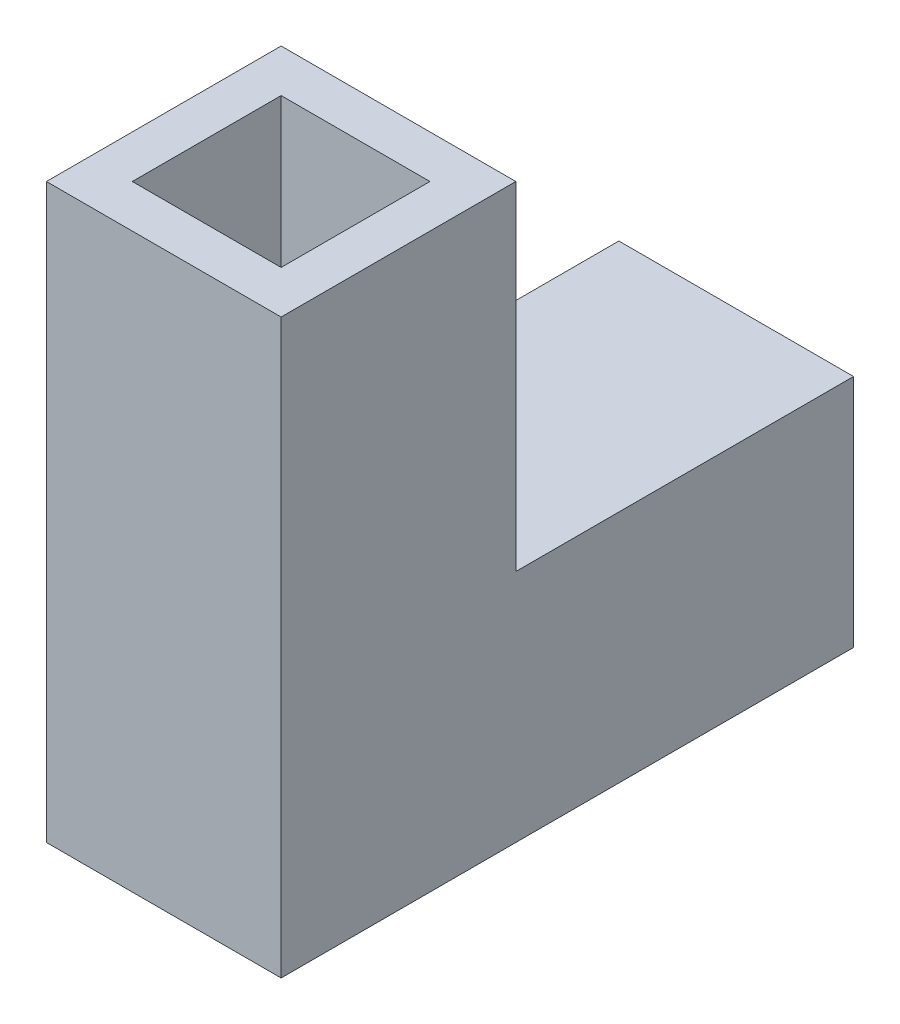
from build123d import *

# Parameters (mm, degrees)
SKETCH1_W           = 8.2
SKETCH1_H           = 8.2
SKETCH1_W_2         = 5.2
SKETCH1_H_2         = 5.2
BOSS_EXTRUDE1_DEPTH = 20
SKETCH2_W           = 8.2
SKETCH2_H           = 8.2
BOSS_EXTRUDE2_DEPTH = 20
SHELL1_T            = -1.5


with BuildPart() as part:
    # Sketch1 → Boss-Extrude1 (new body)
    # profile 1 of 2: a face of its own
    with BuildSketch(Plane(origin=(0, 0, 0), x_dir=(1, 0, 0), z_dir=(0, 1, 0))):
        Rectangle(SKETCH1_W, SKETCH1_H)
        Rectangle(SKETCH1_W_2, SKETCH1_H_2, mode=Mode.SUBTRACT)
    # profile 2 of 2: a face of its own
    with BuildSketch(Plane(origin=(0, 0, 0), x_dir=(1, 0, 0), z_dir=(0, 1, 0))):
        Rectangle(SKETCH1_W_2, SKETCH1_H_2)
    extrude(amount=BOSS_EXTRUDE1_DEPTH)

    # Sketch2 → Boss-Extrude2 (add)
    with BuildSketch(Plane(origin=(0, 0, 4.1), x_dir=(-1, 0, 0), z_dir=(0, 0, -1))):
        with Locations((0, 4.1)):
            Rectangle(SKETCH2_W, SKETCH2_H)
    extrude(amount=BOSS_EXTRUDE2_DEPTH)

    # Shell1
    shell1_openings = [part.faces().sort_by_distance(p)[0] for p in [
        (0, 20, 0),
        (0, 4.1, -15.9),
    ]]
    offset(amount=SHELL1_T, openings=shell1_openings, kind=Kind.INTERSECTION)


solid = part.part
